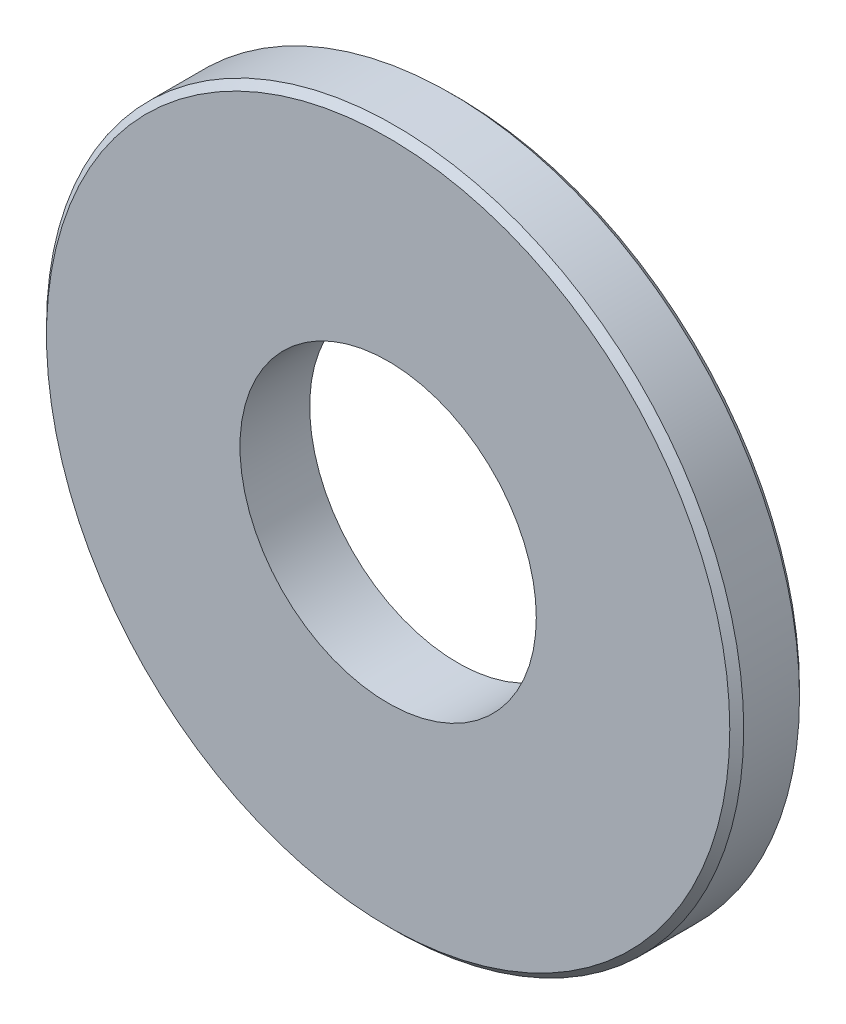
from build123d import *

# Parameters (mm, degrees)
SKETCH1_R           = 10
SKETCH1_R_2         = 4.25
BOSS_EXTRUDE1_DEPTH = 2
CHAMFER1_SIZE       = 0.2


with BuildPart() as part:
    # Sketch1 → Boss-Extrude1 (new body)
    with BuildSketch(Plane.XY):
        Circle(SKETCH1_R)
        Circle(SKETCH1_R_2, mode=Mode.SUBTRACT)
    extrude(amount=BOSS_EXTRUDE1_DEPTH)

    # Chamfer1
    chamfer1_edges = [part.edges().sort_by_distance(p)[0] for p in [
        (-10, 0, 0),
        (-10, 0, 2),
    ]]
    chamfer(chamfer1_edges, length=CHAMFER1_SIZE)


solid = part.part
